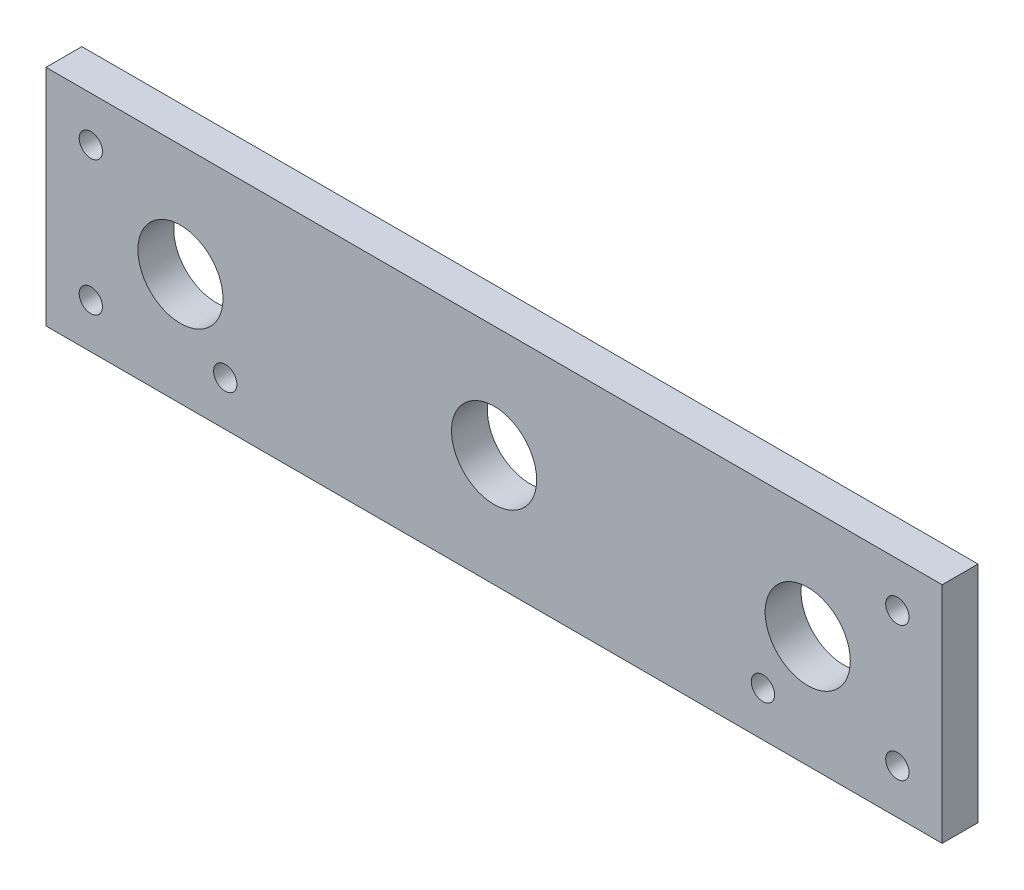
from build123d import *

# Parameters (mm, degrees)
IZIM1_W                              = 100
IZIM1_H                              = 50
IZIM1_R                              = 2.476303865
IZIM1_R_2                            = 9.5
IZIM1_R_3                            = 2.283039358
Y_KSEKLIK_EKSTR_ZYON1_DEPTH          = 8
M5_HELISARMAL_I_IN_Z_VANA_MATKAB_1_D = 5.2
M5_HELISARMAL_I_IN_Z_VANA_MATKAB_2_D = 5.2
KES_EKSTR_ZYON1_DEPTH                = 10


with BuildPart() as part:
    # Çizim1 → Yükseklik-Ekstrüzyon1 (new body)
    # profile 1 of 6: a face of its own
    with BuildSketch(Plane.XY):
        with Locations((91.850220264, -26.688693098)):
            Rectangle(IZIM1_W, IZIM1_H)
        with Locations((131.850220264, -41.688693098)):
            Circle(IZIM1_R, mode=Mode.SUBTRACT)
        with Locations((111.850220264, -26.688693098)):
            Circle(IZIM1_R_2, mode=Mode.SUBTRACT)
        with Locations((131.850220264, -11.688693098)):
            Circle(IZIM1_R_3, mode=Mode.SUBTRACT)
    # profile 2 of 6: a face of its own
    with BuildSketch(Plane.XY):
        with Locations((-8.149779736, -26.688693098)):
            Rectangle(IZIM1_W, IZIM1_H)
        with Locations((-48.149779736, -41.688693098)):
            Circle(IZIM1_R, mode=Mode.SUBTRACT)
        with Locations((-28.149779736, -26.688693098)):
            Circle(IZIM1_R_2, mode=Mode.SUBTRACT)
        with Locations((-48.149779736, -11.688693098)):
            Circle(IZIM1_R_3, mode=Mode.SUBTRACT)
    # profile 3 of 6: a face of its own
    with BuildSketch(Plane.XY):
        with Locations((-48.149779736, -11.688693098)):
            Circle(IZIM1_R_3)
    # profile 4 of 6: a face of its own
    with BuildSketch(Plane.XY):
        with Locations((-48.149779736, -41.688693098)):
            Circle(IZIM1_R)
    # profile 5 of 6: a face of its own
    with BuildSketch(Plane.XY):
        with Locations((131.850220264, -11.688693098)):
            Circle(IZIM1_R_3)
    # profile 6 of 6: a face of its own
    with BuildSketch(Plane.XY):
        with Locations((131.850220264, -41.688693098)):
            Circle(IZIM1_R)
    extrude(amount=Y_KSEKLIK_EKSTR_ZYON1_DEPTH)

    # M5 Helisarmal için Zıvana matkabı1 (through all)
    with Locations(Plane.XY.offset(8)):
        with Locations((-48.149779736, -11.688693098), (-48.149779736, -41.688693098), (131.850220264, -41.688693098), (131.850220264, -11.688693098)):
            Hole(M5_HELISARMAL_I_IN_Z_VANA_MATKAB_1_D / 2)

    # M5 Helisarmal için Zıvana matkabı2 (through all)
    with Locations(Plane(origin=(-18.149779736, -41.688693098, 8), x_dir=(1, 0, 0), z_dir=(0, 0, 1))):
        with Locations((0, 0), (120, 0)):
            Hole(M5_HELISARMAL_I_IN_Z_VANA_MATKAB_2_D / 2)

    # Çizim7 → Kes-Ekstrüzyon1 (cut)
    with BuildSketch(Plane.XY.offset(8)):
        with BuildLine():
            ThreePointArc((51.350220264, -26.688693098), (48.567734686, -19.971178677), (41.850220264, -17.188693098))
            Line((41.850220264, -17.188693098), (41.850220264, -36.188693098))
            ThreePointArc((41.850220264, -36.188693098), (48.567734686, -33.40620752), (51.350220264, -26.688693098))
        make_face()
        with BuildLine():
            Line((41.850220264, -36.188693098), (41.850220264, -17.188693098))
            ThreePointArc((41.850220264, -17.188693098), (32.350220264, -26.688693098), (41.850220264, -36.188693098))
        make_face()
    extrude(amount=-KES_EKSTR_ZYON1_DEPTH, mode=Mode.SUBTRACT)


solid = part.part
